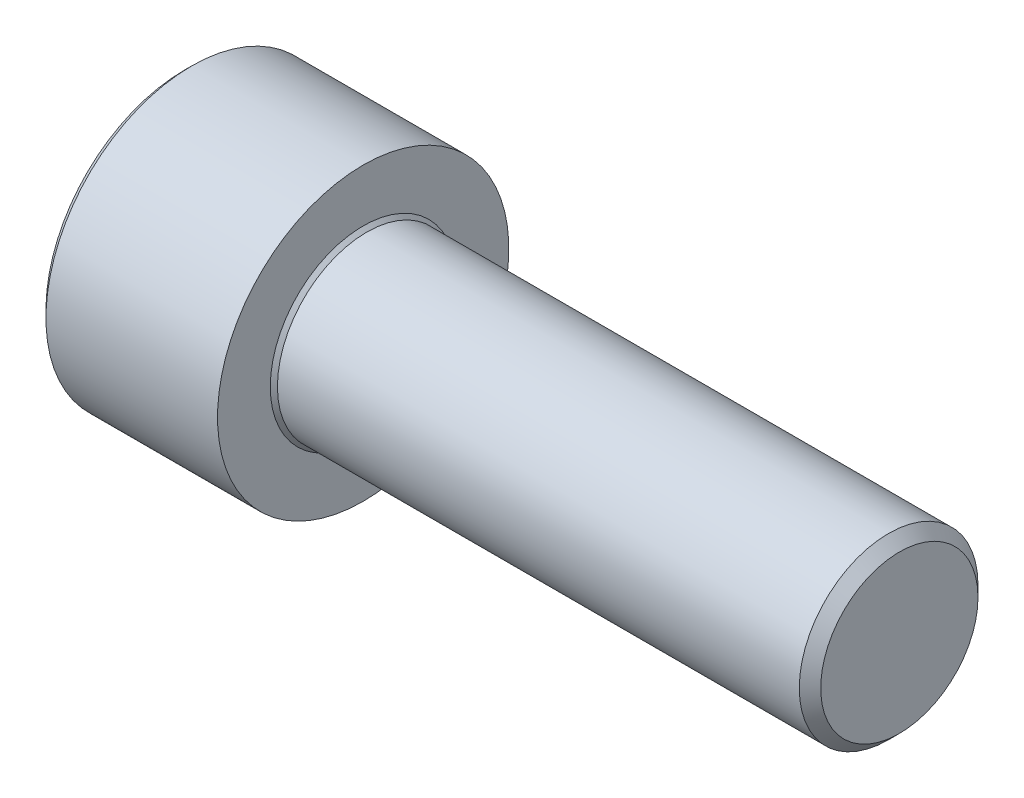
from build123d import *

# Parameters (mm, degrees)
SKETCH2_R           = 5
BOSS_EXTRUDE1_DEPTH = 30
CHAMFER1_SIZE       = 0.6
SKETCH6_W           = 10
SKETCH6_H           = 8.15
CUT_EXTRUDE1_DEPTH  = 5
SKETCH8_R           = 4.72653718
CUT_EXTRUDE2_DEPTH  = 1
CUT_EXTRUDE2_DRAFT  = -45
CHAMFER2_SIZE       = 0.4
CHAMFER3_SIZE       = 0.2


with BuildPart() as part:
    # Sketch2 → Boss-Extrude1 (new body)
    with BuildSketch(Plane(origin=(0, 0, 0), x_dir=(0, 0, -1), z_dir=(1, 0, 0))):
        Circle(SKETCH2_R)
    extrude(amount=-BOSS_EXTRUDE1_DEPTH)

    # Chamfer1
    chamfer1_edges = [part.edges().sort_by_distance(p)[0] for p in [
        (0, 0, 5),
    ]]
    chamfer(chamfer1_edges, length=CHAMFER1_SIZE)

    # Sketch6 → Revolve1 (revolve)
    with BuildSketch(Plane.XY, mode=Mode.PRIVATE) as revolve1_sk:
        with Locations((-35, 4.075)):
            Rectangle(SKETCH6_W, SKETCH6_H)
    revolve(revolve1_sk.sketch.rotate(Axis((-30, 0, 0), (1, 0, 0)), 180), axis=Axis((-30, 0, 0), (1, 0, 0)))

    # Sketch7 → Cut-Extrude1 (cut)
    with BuildSketch(Plane.ZY.offset(40)):
        Polygon((0, 4.67653718), (-4.05, 2.33826859), (-4.05, -2.33826859), (0, -4.67653718), (4.05, -2.33826859), (4.05, 2.33826859), align=None)
    extrude(amount=-CUT_EXTRUDE1_DEPTH, mode=Mode.SUBTRACT)


with BuildPart() as cut_extrude2_tool:
    # Sketch8 → Cut-Extrude2 (with draft: the straight prism first)
    with BuildSketch(Plane.ZY.offset(40)):
        Circle(SKETCH8_R)
    extrude(amount=-CUT_EXTRUDE2_DEPTH)
    # Cut-Extrude2: the draft: its side faces are tilted about the plane it starts from
    cut_extrude2_sides = [cut_extrude2_tool.faces().sort_by_distance(p)[0] for p in [
        (-39.5, 0, -4.72653718),
    ]]
    draft(cut_extrude2_sides, Plane.ZY.offset(40), CUT_EXTRUDE2_DRAFT)


with BuildPart() as part_1:
    add(part.part)

    # Cut-Extrude2: cut by cut_extrude2_tool
    add(cut_extrude2_tool.part, mode=Mode.SUBTRACT)

    # Chamfer2
    chamfer2_edges = [part_1.edges().sort_by_distance(p)[0] for p in [
        (-40, 8.15, 0),
    ]]
    chamfer(chamfer2_edges, length=CHAMFER2_SIZE)

    # Chamfer3
    chamfer3_edges = [part_1.edges().sort_by_distance(p)[0] for p in [
        (-30, 0, 5),
    ]]
    chamfer(chamfer3_edges, length=CHAMFER3_SIZE)


solid = part_1.part
